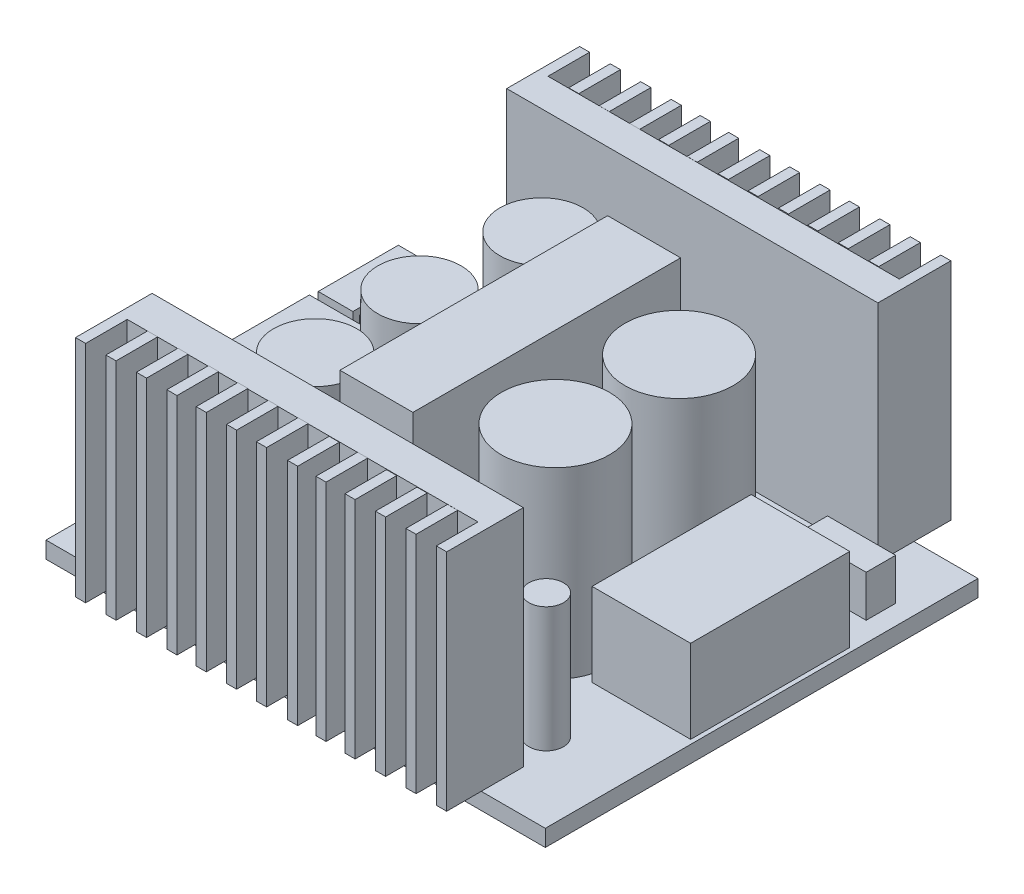
from build123d import *

# Parameters (mm, degrees)
SKIZZE1_W                        = 60
SKIZZE1_H                        = 52
AUFSATZ_LINEAR_AUSTRAGEN1_DEPTH  = 2
SKIZZE2_W                        = 4.171328817
SKIZZE2_H                        = 9.629375294
SKIZZE2_H_2                      = 9.629375295
AUFSATZ_LINEAR_AUSTRAGEN2_DEPTH  = 10
SKIZZE3_W                        = 11.843772269
SKIZZE3_H                        = 19.121604294
SKIZZE3_H_2                      = 19.121604293
AUFSATZ_LINEAR_AUSTRAGEN3_DEPTH  = 10
SKIZZE4_R                        = 2.072288809
AUFSATZ_LINEAR_AUSTRAGEN4_DEPTH  = 15
SKIZZE5_W                        = 8.191020073
SKIZZE5_H                        = 3.542062735
AUFSATZ_LINEAR_AUSTRAGEN5_DEPTH  = 5
SKIZZE6_W                        = 44.607852562
SKIZZE6_H                        = 3.763441655
SKIZZE6_H_2                      = 4.206199497
AUFSATZ_LINEAR_AUSTRAGEN6_DEPTH  = 27
SKIZZE7_R                        = 5
SKIZZE7_R_2                      = 6.5
AUFSATZ_LINEAR_AUSTRAGEN7_DEPTH  = 22
SKIZZE8_W                        = 8.773032398
SKIZZE8_H                        = 32.167785459
AUFSATZ_LINEAR_AUSTRAGEN8_DEPTH  = 25
SKIZZE9_W                        = 1.22
SKIZZE9_H                        = 27
SKIZZE9_W_2                      = 1.198395349
SKIZZE9_H_2                      = 26.967916188
SKIZZE9_W_3                      = 1.238034023
AUFSATZ_LINEAR_AUSTRAGEN9_DEPTH  = 5
SKIZZE10_W                       = 1.22
SKIZZE10_H                       = 27
SKIZZE10_W_2                     = 1.198395349
SKIZZE10_H_2                     = 26.967916188
SKIZZE10_W_3                     = 1.196647202
AUFSATZ_LINEAR_AUSTRAGEN10_DEPTH = 5


with BuildPart() as part:
    # Skizze1 → Aufsatz-Linear austragen1 (new body)
    with BuildSketch(Plane(origin=(0, 0, 0), x_dir=(1, 0, 0), z_dir=(0, 1, 0))):
        Rectangle(SKIZZE1_W, SKIZZE1_H)
    extrude(amount=AUFSATZ_LINEAR_AUSTRAGEN1_DEPTH)

    # Skizze2 → Aufsatz-Linear austragen2 (add)
    with BuildSketch(Plane(origin=(0, 2, 0), x_dir=(1, 0, 0), z_dir=(0, 1, 0))):
        with Locations((-27.429980224, 11.040969798)):
            Rectangle(SKIZZE2_W, SKIZZE2_H)
        with Locations((-22.466389845, 11.024313198)):
            Rectangle(SKIZZE2_W, SKIZZE2_H_2)
    extrude(amount=AUFSATZ_LINEAR_AUSTRAGEN2_DEPTH)

    # Skizze3 → Aufsatz-Linear austragen3 (add)
    with BuildSketch(Plane(origin=(0, 2, 0), x_dir=(1, 0, 0), z_dir=(0, 1, 0))):
        with Locations((23.554785505, 1.549851865)):
            Rectangle(SKIZZE3_W, SKIZZE3_H)
        with Locations((-23.759716727, -4.226654643)):
            Rectangle(SKIZZE3_W, SKIZZE3_H_2)
    extrude(amount=AUFSATZ_LINEAR_AUSTRAGEN3_DEPTH)

    # Skizze4 → Aufsatz-Linear austragen4 (add)
    with BuildSketch(Plane(origin=(0, 2, 0), x_dir=(1, 0, 0), z_dir=(0, 1, 0))):
        with Locations(Location((20.536465542, -16.425780337, 0), (0, 0, 90))):
            Circle(SKIZZE4_R)
    extrude(amount=AUFSATZ_LINEAR_AUSTRAGEN4_DEPTH)

    # Skizze5 → Aufsatz-Linear austragen5 (add)
    with BuildSketch(Plane(origin=(0, 2, 0), x_dir=(1, 0, 0), z_dir=(0, 1, 0))):
        with Locations((23.538626636, 16.697381153)):
            Rectangle(SKIZZE5_W, SKIZZE5_H)
    extrude(amount=AUFSATZ_LINEAR_AUSTRAGEN5_DEPTH)

    # Skizze6 → Aufsatz-Linear austragen6 (add)
    with BuildSketch(Plane(origin=(0, 2, 0), x_dir=(1, 0, 0), z_dir=(0, 1, 0))):
        with Locations((0, 23.549182712)):
            Rectangle(SKIZZE6_W, SKIZZE6_H)
        with Locations((0, -23.05108014)):
            Rectangle(SKIZZE6_W, SKIZZE6_H_2)
    extrude(amount=AUFSATZ_LINEAR_AUSTRAGEN6_DEPTH)

    # Skizze7 → Aufsatz-Linear austragen7 (add)
    with BuildSketch(Plane(origin=(0, 2, 0), x_dir=(1, 0, 0), z_dir=(0, 1, 0))):
        with Locations(Location((-11.604540209, 0.487390689, 0), (0, 0, 90))):
            Circle(SKIZZE7_R)
        with Locations(Location((-10.304831705, 13.855821009, 0), (0, 0, 90))):
            Circle(SKIZZE7_R)
        with Locations(Location((-11.326031244, -12.324021702, 0), (0, 0, 90))):
            Circle(SKIZZE7_R)
        with Locations(Location((10.722595153, 9.353259408, 0), (0, 0, 90))):
            Circle(SKIZZE7_R_2)
        with Locations(Location((10.490504349, -5.268461255, 0), (0, 0, 90))):
            Circle(SKIZZE7_R_2)
    extrude(amount=AUFSATZ_LINEAR_AUSTRAGEN7_DEPTH)

    # Skizze8 → Aufsatz-Linear austragen8 (add)
    with BuildSketch(Plane(origin=(0, 2, 0), x_dir=(1, 0, 0), z_dir=(0, 1, 0))):
        with Locations((-0.626645171, 0.417763447)):
            Rectangle(SKIZZE8_W, SKIZZE8_H)
    extrude(amount=AUFSATZ_LINEAR_AUSTRAGEN8_DEPTH)

    # Skizze9 → Aufsatz-Linear austragen9 (add)
    with BuildSketch(Plane.XY.offset(25.154179888)):
        with Locations((-21.693926281, 15.5)):
            Rectangle(SKIZZE9_W, SKIZZE9_H)
        with Locations((-18.033926281, 15.513977132)):
            Rectangle(SKIZZE9_W, SKIZZE9_H)
        with Locations((-14.373926281, 15.548375388)):
            Rectangle(SKIZZE9_W, SKIZZE9_H)
        with Locations((-10.713926281, 15.56235252)):
            Rectangle(SKIZZE9_W, SKIZZE9_H)
        with Locations((-7.186859691, 15.565574516)):
            Rectangle(SKIZZE9_W, SKIZZE9_H)
        with Locations((-3.537662017, 15.563509742)):
            Rectangle(SKIZZE9_W_2, SKIZZE9_H_2)
        with Locations((0.050366666, 15.53117626)):
            Rectangle(SKIZZE9_W, SKIZZE9_H)
        with Locations((3.793140309, 15.462379749)):
            Rectangle(SKIZZE9_W, SKIZZE9_H)
        with Locations((10.692247294, 15.44141405)):
            Rectangle(SKIZZE9_W, SKIZZE9_H)
        with Locations((14.352247294, 15.455391183)):
            Rectangle(SKIZZE9_W, SKIZZE9_H)
        with Locations((18.012247294, 15.489789438)):
            Rectangle(SKIZZE9_W, SKIZZE9_H)
        with Locations((7.20130698, 15.513977132)):
            Rectangle(SKIZZE9_W, SKIZZE9_H)
        with Locations((21.68490927, 15.5)):
            Rectangle(SKIZZE9_W_3, SKIZZE9_H)
    extrude(amount=AUFSATZ_LINEAR_AUSTRAGEN9_DEPTH)

    # Skizze10 → Aufsatz-Linear austragen10 (add)
    with BuildSketch(Plane(origin=(0, 0, -25.430903539), x_dir=(-1, 0, 0), z_dir=(0, 0, -1))):
        with Locations((-18.033926281, 15.565538052)):
            Rectangle(SKIZZE10_W, SKIZZE10_H)
        with Locations((-14.373926281, 15.599936307)):
            Rectangle(SKIZZE10_W, SKIZZE10_H)
        with Locations((-10.713926281, 15.61391344)):
            Rectangle(SKIZZE10_W, SKIZZE10_H)
        with Locations((-7.186859691, 15.617135435)):
            Rectangle(SKIZZE10_W, SKIZZE10_H)
        with Locations((-3.537662017, 15.615070662)):
            Rectangle(SKIZZE10_W_2, SKIZZE10_H_2)
        with Locations((0.050366666, 15.58273718)):
            Rectangle(SKIZZE10_W, SKIZZE10_H)
        with Locations((3.793140309, 15.513940668)):
            Rectangle(SKIZZE10_W, SKIZZE10_H)
        with Locations((10.692247294, 15.49297497)):
            Rectangle(SKIZZE10_W, SKIZZE10_H)
        with Locations((14.352247294, 15.506952102)):
            Rectangle(SKIZZE10_W, SKIZZE10_H)
        with Locations((18.012247294, 15.541350358)):
            Rectangle(SKIZZE10_W, SKIZZE10_H)
        with Locations((7.20130698, 15.565538052)):
            Rectangle(SKIZZE10_W, SKIZZE10_H)
        with Locations((-21.70560268, 15.5)):
            Rectangle(SKIZZE10_W_3, SKIZZE10_H)
        with Locations((21.70560268, 15.5)):
            Rectangle(SKIZZE10_W_3, SKIZZE10_H)
    extrude(amount=AUFSATZ_LINEAR_AUSTRAGEN10_DEPTH)


solid = part.part
